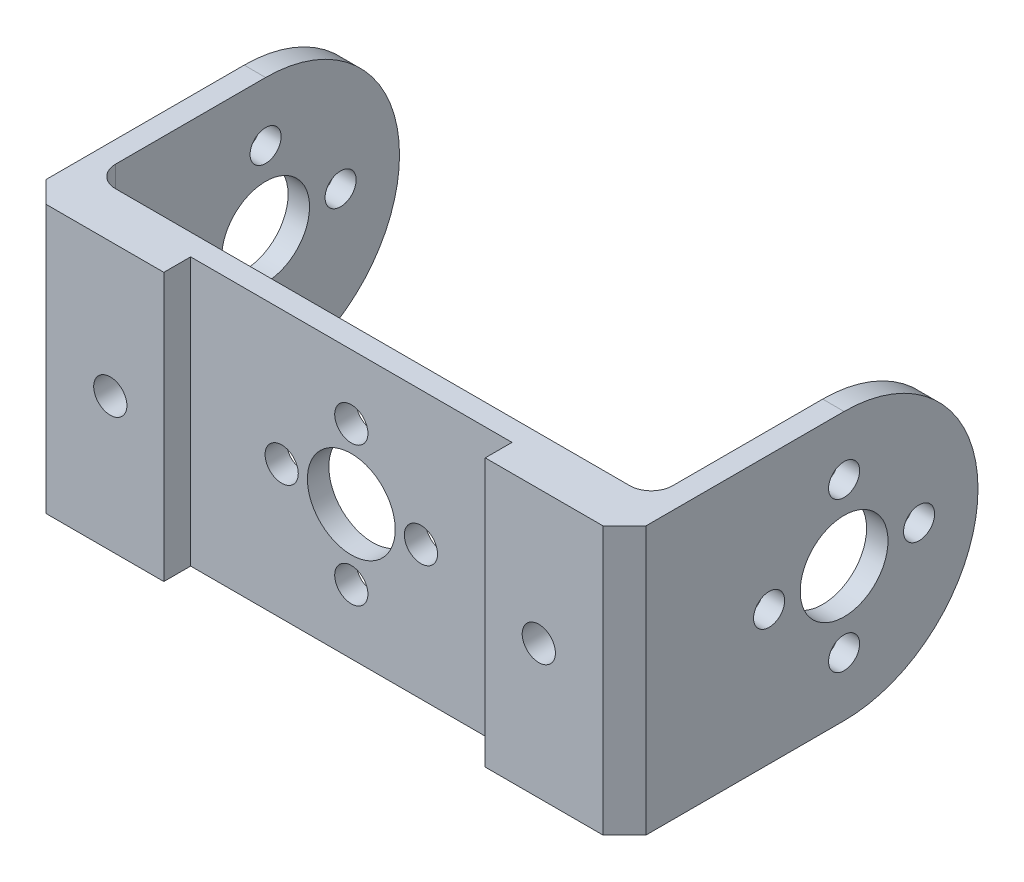
from build123d import *

# Parameters (mm, degrees)
SKETCH_1_W          = 56
SKETCH_1_H          = 25
EXTRUDE_1_DEPTH     = 2
SKETCH_2_R          = 1.45
EXTRUDE_2_DEPTH     = 2
SKETCH_3_R          = 1.55
SKETCH_3_R_2        = 4.1
CUT_EXTRUDE_1_DEPTH = 2
FILLET_1_R          = 2
EXTRUDE_START       = 2.5
SKETCH_4_W          = 13
SKETCH_4_H          = 25
SKETCH_4_R          = 1.55
EXTRUDE_3_DEPTH     = 2.5
CHAMFER_1_SIZE      = 2


with BuildPart() as part:
    # 草图1 → 凸台-拉伸1 (new body)
    with BuildSketch(Plane.XY):
        Rectangle(SKETCH_1_W, SKETCH_1_H)
    extrude(amount=EXTRUDE_1_DEPTH)

    # 草图2 → 凸台-拉伸2 (add)
    with BuildSketch(Plane(origin=(28, 0, 0), x_dir=(0, 0, -1), z_dir=(1, 0, 0))):
        with BuildLine():
            Line((16, 12.5), (0, 12.5))
            Line((0, 12.5), (0, -12.5))
            Line((0, -12.5), (16, -12.5))
            ThreePointArc((16, -12.5), (21.8630197, -11.039701083), (26.356157589, -7))
            ThreePointArc((26.356157589, -7), (27.31423641, -5.313949046), (28, -3.5))
            ThreePointArc((28, -3.5), (28.374368671, -1.767766953), (28.5, 0))
            ThreePointArc((28.5, 0), (24.838834765, 8.838834765), (16, 12.5))
        make_face()
        with Locations((9, 0)):
            Circle(SKETCH_2_R, mode=Mode.SUBTRACT)
        with Locations((16, -7)):
            Circle(SKETCH_2_R, mode=Mode.SUBTRACT)
        with BuildLine():
            ThreePointArc((16, 4.1), (18.899137803, 2.899137803), (20.1, 0))
            ThreePointArc((20.1, 0), (13.100862197, -2.899137803), (16, 4.1))
        make_face(mode=Mode.SUBTRACT)
        with BuildLine():
            ThreePointArc((24.45, 0), (23, -1.45), (21.55, 0))
            ThreePointArc((21.55, 0), (23, 1.45), (24.45, 0))
        make_face(mode=Mode.SUBTRACT)
        with BuildLine():
            ThreePointArc((17.45, 7), (17.025304833, 5.974695167), (16, 5.55))
            ThreePointArc((16, 5.55), (14.974695167, 5.974695167), (14.55, 7))
            ThreePointArc((14.55, 7), (14.974695167, 8.025304833), (16, 8.45))
            ThreePointArc((16, 8.45), (17.025304833, 8.025304833), (17.45, 7))
        make_face(mode=Mode.SUBTRACT)
    extrude_2 = extrude(amount=-EXTRUDE_2_DEPTH)

    # 镜向2: 凸台-拉伸2 across plane
    add(extrude_2.mirror(Plane.ZY))

    # 草图3 → 切除-拉伸1 (cut)
    with BuildSketch(Plane.XY.offset(2)):
        with Locations((-20, 0)):
            Circle(SKETCH_3_R)
        with Locations((-6.5, 0)):
            Circle(SKETCH_3_R)
        with Locations((6.5, 0)):
            Circle(SKETCH_3_R)
        with Locations((0, -6.5)):
            Circle(SKETCH_3_R)
        Circle(SKETCH_3_R_2)
        with Locations((0, 6.5)):
            Circle(SKETCH_3_R)
        with Locations((20, 0)):
            Circle(SKETCH_3_R)
    extrude(amount=-CUT_EXTRUDE_1_DEPTH, mode=Mode.SUBTRACT)

    # 圆角1
    fillet_1_edges = [part.edges().sort_by_distance(p)[0] for p in [
        (26, 0, 0),
        (-26, 0, 0),
    ]]
    fillet(fillet_1_edges, radius=FILLET_1_R)

    # 草图4 → 凸台-拉伸3 (add)
    # profile 1 of 2: a face of its own
    with BuildSketch(Plane.XY.offset(2).offset(EXTRUDE_START)):
        with Locations((-21.5, 0)):
            Rectangle(SKETCH_4_W, SKETCH_4_H)
        with Locations((-20, 0)):
            Circle(SKETCH_4_R, mode=Mode.SUBTRACT)
    # profile 2 of 2: a face of its own
    with BuildSketch(Plane.XY.offset(2).offset(EXTRUDE_START)):
        with Locations((21.5, 0)):
            Rectangle(SKETCH_4_W, SKETCH_4_H)
        with Locations((20, 0)):
            Circle(SKETCH_4_R, mode=Mode.SUBTRACT)
    extrude(amount=-EXTRUDE_3_DEPTH)

    # 倒角1
    chamfer_1_edges = [part.edges().sort_by_distance(p)[0] for p in [
        (28, 0, 4.5),
        (-28, 0, 4.5),
    ]]
    chamfer(chamfer_1_edges, length=CHAMFER_1_SIZE)


solid = part.part
